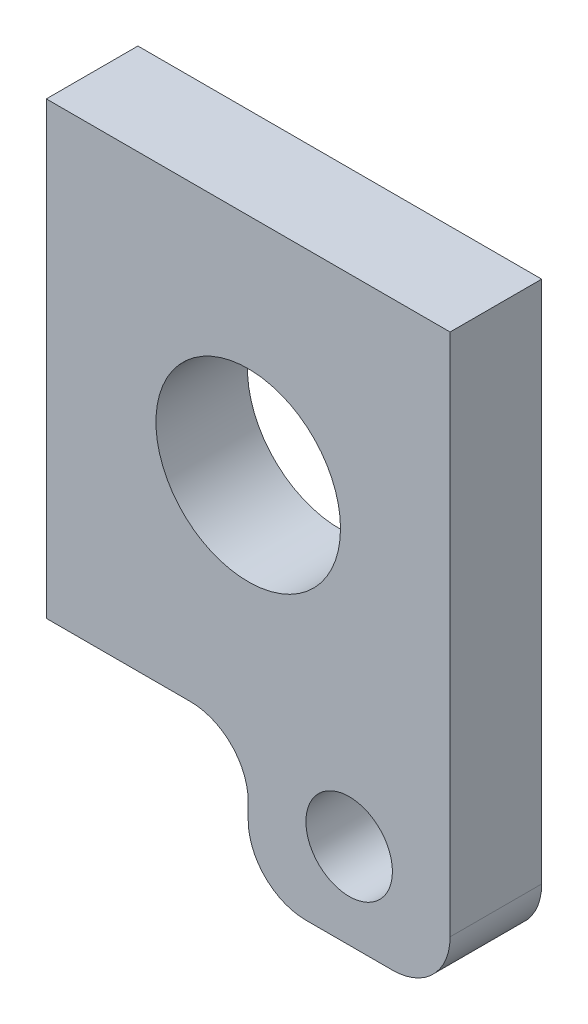
from build123d import *

# Parameters (mm, degrees)
SKETCH1_R           = 1.6
SKETCH1_R_2         = 0.75
BOSS_EXTRUDE1_DEPTH = 1.5875
MOVE_FACE2_BY       = 0.1
FILLET3_R           = 1


with BuildPart() as part:
    # Sketch1 → Boss-Extrude1 (new body)
    with BuildSketch(Plane.XY):
        Polygon((-3.5, -3.9), (-3.5, 3.9), (3.5, 3.9), (3.5, -3.9), (3.5, -6.28125), (0, -6.28125), (0, -3.9), align=None)
        Circle(SKETCH1_R, mode=Mode.SUBTRACT)
        with Locations((1.75, -4.7)):
            Circle(SKETCH1_R_2, mode=Mode.SUBTRACT)
    extrude(amount=BOSS_EXTRUDE1_DEPTH)

    # Move Face2: a face moved inward by 0.1
    extrude(part.faces().sort_by_distance((1.75, -6.28125, 0.79375))[0], amount=MOVE_FACE2_BY, dir=(0, 1, 0), mode=Mode.SUBTRACT)

    # Fillet3
    fillet3_edges = [part.edges().sort_by_distance(p)[0] for p in [
        (3.5, -6.18125, 0.79375),
        (0, -6.18125, 0.79375),
        (0, -3.9, 0.79375),
    ]]
    fillet(fillet3_edges, radius=FILLET3_R)


solid = part.part
